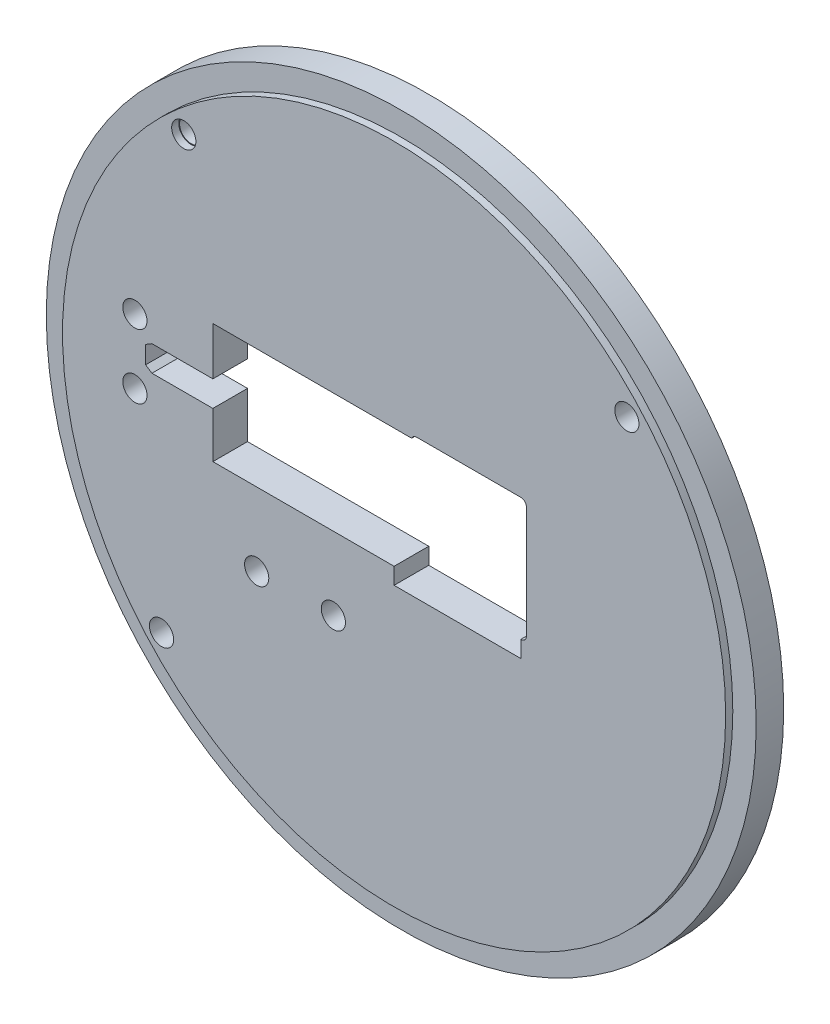
from build123d import *

# Parameters (mm, degrees)
SCHIZZO1_R                   = 60.25
ESTRUSIONE_ESTRUSIONE1_DEPTH = 1.3
SCHIZZO1_6_R                 = 64.5
SCHIZZO1_6_R_2               = 60.25
ESTRUSIONE_ESTRUSIONE2_DEPTH = 5
ESTRUSIONE_ESTRUSIONE3_START = 5
SCHIZZO2_R                   = 60.25
ESTRUSIONE_ESTRUSIONE3_DEPTH = 5
SCHIZZO4_R                   = 2.2
TAGLIO_ESTRUSIONE1_DEPTH     = 22.55
SCHIZZO5_R                   = 2.2
SCHIZZO5_R_2                 = 2.063369246
TAGLIO_ESTRUSIONE2_DEPTH     = 92.35370819
SCHIZZO6_R                   = 3.55
TAGLIO_ESTRUSIONE3_DEPTH     = 3
TAGLIO_ESTRUSIONE4_DEPTH     = 92.434074611
TAGLIO_ESTRUSIONE5_DEPTH     = 92.434074611
SCHIZZO19_R                  = 2.2
TAGLIO_ESTRUSIONE6_DEPTH     = 92.434074611
SCHIZZO21_W                  = 23.016895474
SCHIZZO21_H                  = 3.000921099
TAGLIO_ESTRUSIONE7_DEPTH     = 92.434074611
SCHIZZO23_W                  = 21.797647442
SCHIZZO23_H                  = 17.331114079
TAGLIO_ESTRUSIONE8_DEPTH     = 92.434074611
SCHIZZO24_W                  = 6.255388186
SCHIZZO24_H                  = 0.117454314
TAGLIO_ESTRUSIONE9_DEPTH     = 92.35370819
SCHIZZO25_W                  = 6.255388186
SCHIZZO25_H                  = 0.117454314
TAGLIO_ESTRUSIONE10_DEPTH    = 92.434074611


with BuildPart() as part:
    # Schizzo1 → Estrusione-Estrusione1 (new body)
    with BuildSketch(Plane.XY):
        Circle(SCHIZZO1_R)
    extrude(amount=ESTRUSIONE_ESTRUSIONE1_DEPTH)


with BuildPart() as body_2:
    # Schizzo1<6> → Estrusione-Estrusione2 (new body)
    with BuildSketch(Plane.XY):
        Circle(SCHIZZO1_6_R)
        Circle(SCHIZZO1_6_R_2, mode=Mode.SUBTRACT)
    extrude(amount=-ESTRUSIONE_ESTRUSIONE2_DEPTH)


with BuildPart() as estrusione_estrusione3_tool:
    # Schizzo2 → Estrusione-Estrusione3 (new body)
    with BuildSketch(Plane(origin=(0, 0, 0), x_dir=(-1, 0, 0), z_dir=(0, 0, -1)).offset(ESTRUSIONE_ESTRUSIONE3_START)):
        Circle(SCHIZZO2_R)
    extrude(amount=-ESTRUSIONE_ESTRUSIONE3_DEPTH)


with BuildPart() as part_1:
    add(part.part)


with BuildPart() as part_2:
    # Estrusione-Estrusione3: joined with estrusione_estrusione3_tool
    add(part_1.part.fuse(estrusione_estrusione3_tool.part, body_2.part, tol=0.00001))

    # Schizzo4 → Taglio-Estrusione1 (cut)
    with BuildSketch(Plane.XY):
        with Locations((-38.215953468, 42.185917173)):
            Circle(SCHIZZO4_R)
        with Locations((42.295854852, 38.002469644)):
            Circle(SCHIZZO4_R)
        with Locations((-42.258051235, -38.212951628)):
            Circle(SCHIZZO4_R)
    extrude(amount=TAGLIO_ESTRUSIONE1_DEPTH, mode=Mode.SUBTRACT)

    # Schizzo5 → Taglio-Estrusione2 (cut, through all)
    with BuildSketch(Plane.XY):
        with Locations((42.295854852, 38.002469644)):
            Circle(SCHIZZO5_R)
        with Locations((-38.215953468, 42.185917173)):
            Circle(SCHIZZO5_R_2)
        with Locations((-42.258051235, -38.212951628)):
            Circle(SCHIZZO5_R)
    extrude(amount=-TAGLIO_ESTRUSIONE2_DEPTH, mode=Mode.SUBTRACT)

    # Schizzo6 → Taglio-Estrusione3 (cut)
    with BuildSketch(Plane(origin=(0, 0, -5), x_dir=(-1, 0, 0), z_dir=(0, 0, -1))):
        with Locations((-42.295854852, 38.002469644)):
            Circle(SCHIZZO6_R)
        with Locations((38.215953468, 42.185917173)):
            Circle(SCHIZZO6_R)
        with Locations((42.258051235, -38.212951628)):
            Circle(SCHIZZO6_R)
    extrude(amount=-TAGLIO_ESTRUSIONE3_DEPTH, mode=Mode.SUBTRACT)

    # Schizzo16 → Taglio-Estrusione4 (cut, through all)
    with BuildSketch(Plane.XY.offset(1.3)):
        with BuildLine():
            Line((-32.928448826, 14.986032767), (-25.1744035, 14.986032767))
            Line((-25.1744035, 14.986032767), (-25.1744035, -0.412845979))
            Line((-25.1744035, -0.412845979), (-8.028134258, -0.412845979))
            Line((-8.028134258, -0.412845979), (-6.936015198, 0.679273081))
            Line((-6.936015198, 0.679273081), (-6.936015198, 13.042885081))
            ThreePointArc((-6.936015198, 13.042885081), (-6.332478846, 14.499950729), (-4.875413198, 15.103487081))
            Line((-4.875413198, 15.103487081), (3.18719168, 15.103487081))
            ThreePointArc((3.18719168, 15.103487081), (3.567159045, 15.553378343), (4.131478144, 15.721667681))
            Line((4.131478144, 15.721667681), (23.016895474, 15.721667681))
            ThreePointArc((23.016895474, 15.721667681), (23.745428298, 15.419899505), (24.047196474, 14.691366681))
            Line((24.047196474, 14.691366681), (24.047196474, -5.607623621))
            ThreePointArc((24.047196474, -5.607623621), (23.745428298, -6.336156444), (23.016895474, -6.637924621))
            Line((23.016895474, -6.637924621), (-32.928448826, -6.637924621))
            Line((-32.928448826, -6.637924621), (-32.928448826, 14.986032767))
        make_face()
    extrude(amount=-TAGLIO_ESTRUSIONE4_DEPTH, mode=Mode.SUBTRACT)

    # Schizzo18 → Taglio-Estrusione5 (cut, through all)
    with BuildSketch(Plane(origin=(0, 0, -5), x_dir=(-1, 0, 0), z_dir=(0, 0, -1))):
        Polygon((44.000647486, 6.387761029), (32.928448826, 6.387761029), (32.928448826, 1.738887547), (44.000647486, 1.737761029), (45.156092105, 2.475905944), (45.20554645, 5.664349962), align=None)
    extrude(amount=-TAGLIO_ESTRUSIONE5_DEPTH, mode=Mode.SUBTRACT)

    # Schizzo19 → Taglio-Estrusione6 (cut, through all)
    with BuildSketch(Plane.XY.offset(1.3)):
        with Locations((-47.096963083, 9.498765652)):
            Circle(SCHIZZO19_R)
        with Locations((-47.096963083, -2.216170811)):
            Circle(SCHIZZO19_R)
        with Locations((-24.967055149, -19.916033665)):
            Circle(SCHIZZO19_R)
        with Locations((-11.036476343, -19.916033665)):
            Circle(SCHIZZO19_R)
    extrude(amount=-TAGLIO_ESTRUSIONE6_DEPTH, mode=Mode.SUBTRACT)

    # Schizzo21 → Taglio-Estrusione7 (cut, through all)
    with BuildSketch(Plane(origin=(0, 0, -5), x_dir=(-1, 0, 0), z_dir=(0, 0, -1))):
        with Locations((-11.508447737, -8.138385171)):
            Rectangle(SCHIZZO21_W, SCHIZZO21_H)
    extrude(amount=-TAGLIO_ESTRUSIONE7_DEPTH, mode=Mode.SUBTRACT)

    # Schizzo23 → Taglio-Estrusione8 (cut, through all)
    with BuildSketch(Plane(origin=(0, 0, -5), x_dir=(-1, 0, 0), z_dir=(0, 0, -1))):
        with Locations((15.774236919, 6.437930042)):
            Rectangle(SCHIZZO23_W, SCHIZZO23_H)
    extrude(amount=-TAGLIO_ESTRUSIONE8_DEPTH, mode=Mode.SUBTRACT)

    # Schizzo24 → Taglio-Estrusione9 (cut, through all)
    with BuildSketch(Plane.XY):
        with Locations((-29.800754733, 15.044759924)):
            Rectangle(SCHIZZO24_W, SCHIZZO24_H)
    extrude(amount=-TAGLIO_ESTRUSIONE9_DEPTH, mode=Mode.SUBTRACT)

    # Schizzo25 → Taglio-Estrusione10 (cut, through all)
    with BuildSketch(Plane.XY.offset(1.3)):
        with Locations((-29.800754733, 15.044759924)):
            Rectangle(SCHIZZO25_W, SCHIZZO25_H)
    extrude(amount=-TAGLIO_ESTRUSIONE10_DEPTH, mode=Mode.SUBTRACT)


solid = part_2.part
